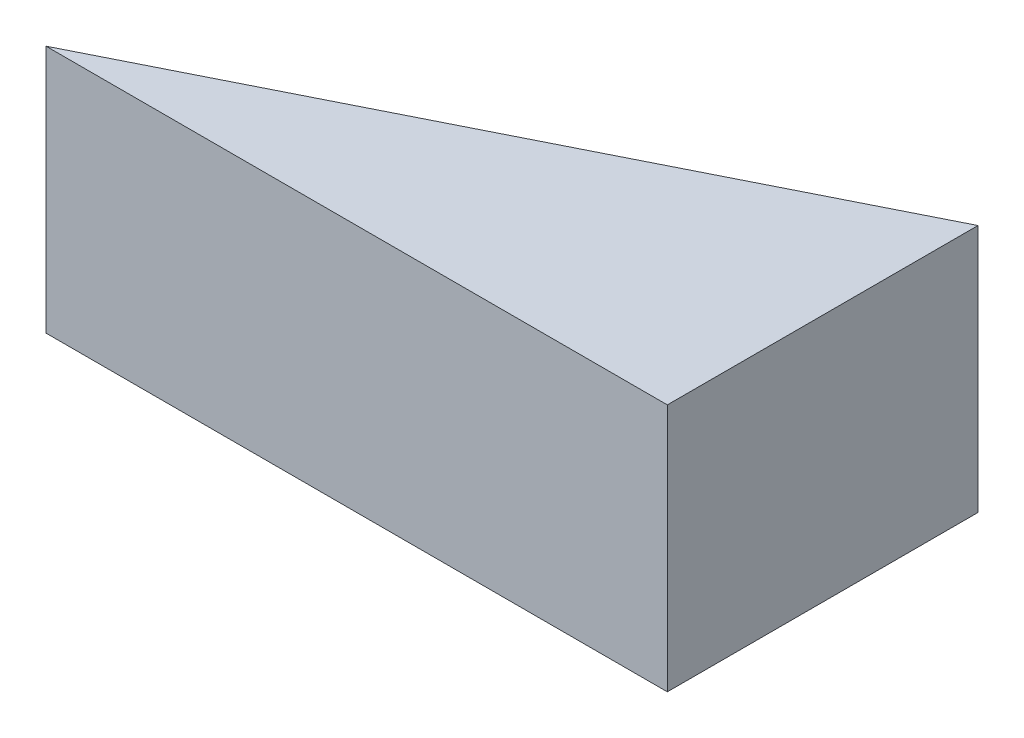
from build123d import *

# Parameters (mm, degrees)
BOSS_EXTRUDE1_DEPTH = 8


with BuildPart() as part:
    # Sketch1 → Boss-Extrude1 (new body)
    with BuildSketch(Plane(origin=(0, 0, 0), x_dir=(1, 0, 0), z_dir=(0, 1, 0))):
        Polygon((0, 10), (0, 0), (-20, 0), align=None)
    extrude(amount=BOSS_EXTRUDE1_DEPTH)


solid = part.part
